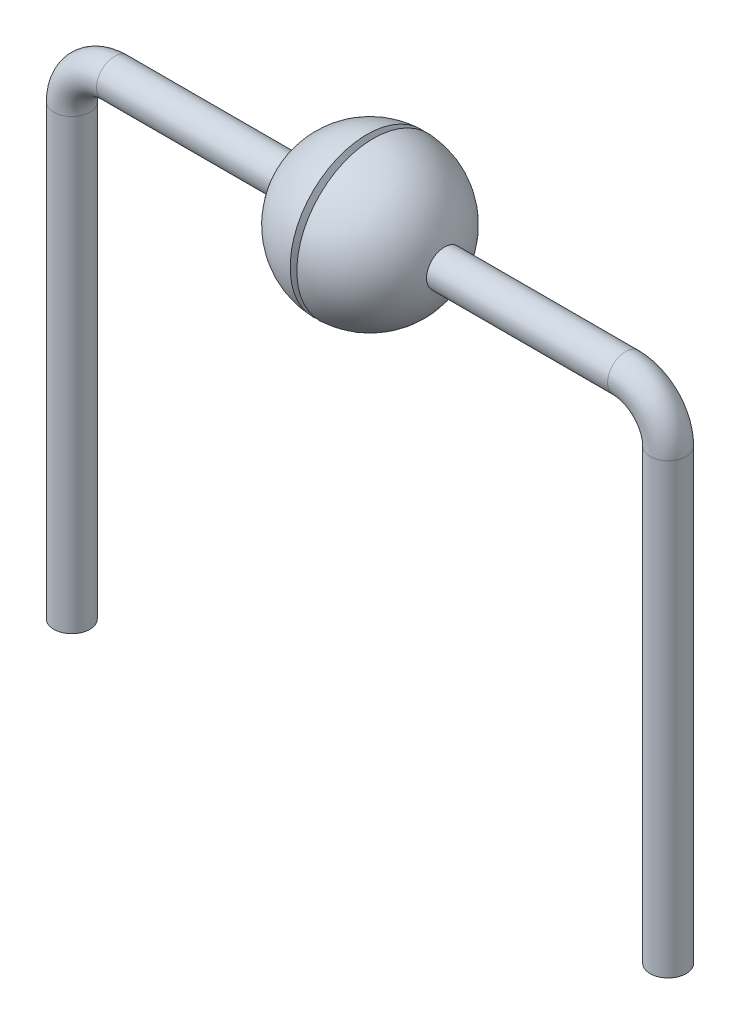
from build123d import *

# Parameters (mm, degrees)
SKETCH_3_R = 0.423054932


with BuildPart() as part:
    # Эскиз1 → Повернуть2 (revolve)
    with BuildSketch(Plane(origin=(0, 0, 0), x_dir=(1, 0, 0), z_dir=(0, 1, 0))):
        with BuildLine():
            Line((-1.749578385, 0.423054932), (-1.749578385, 0))
            Line((-1.749578385, 0), (1.749578385, 0))
            Line((1.749578385, 0), (1.749578385, 0.423054932))
            ThreePointArc((1.749578385, 0.423054932), (1.144753012, 1.389079027), (0.080960724, 1.798178345))
            Line((0.080960724, 1.798178345), (0, 1.645856706))
            Line((0, 1.645856706), (-0.075759465, 1.798404989))
            ThreePointArc((-0.075759465, 1.798404989), (-1.142742977, 1.390733076), (-1.749578385, 0.423054932))
        make_face()
    revolve(axis=Axis((-29.751182373, 0, 0), (1, 0, 0)))

    # По траектории1: sweep along a path in Эскиз2
    with BuildLine(Plane.XY) as sweep_1_path:
        Line((0, 0), (-6, 0))
        ThreePointArc((-6, 0), (-6.707106781, -0.292893219), (-7, -1))
        Line((-7, -1), (-7, -11.514871198))
    # Эскиз3 → По траектории1 (sweep)
    with BuildSketch(Plane.ZY.offset(1.749578385)):
        Circle(SKETCH_3_R)
    sweep_1 = sweep(path=sweep_1_path.line)

    # Зеркальное отражение1: По траектории1 across plane
    add(sweep_1.mirror(Plane(origin=(0, 0, 0), x_dir=(0, 0, 1), z_dir=(1, 0, 0))))


solid = part.part
